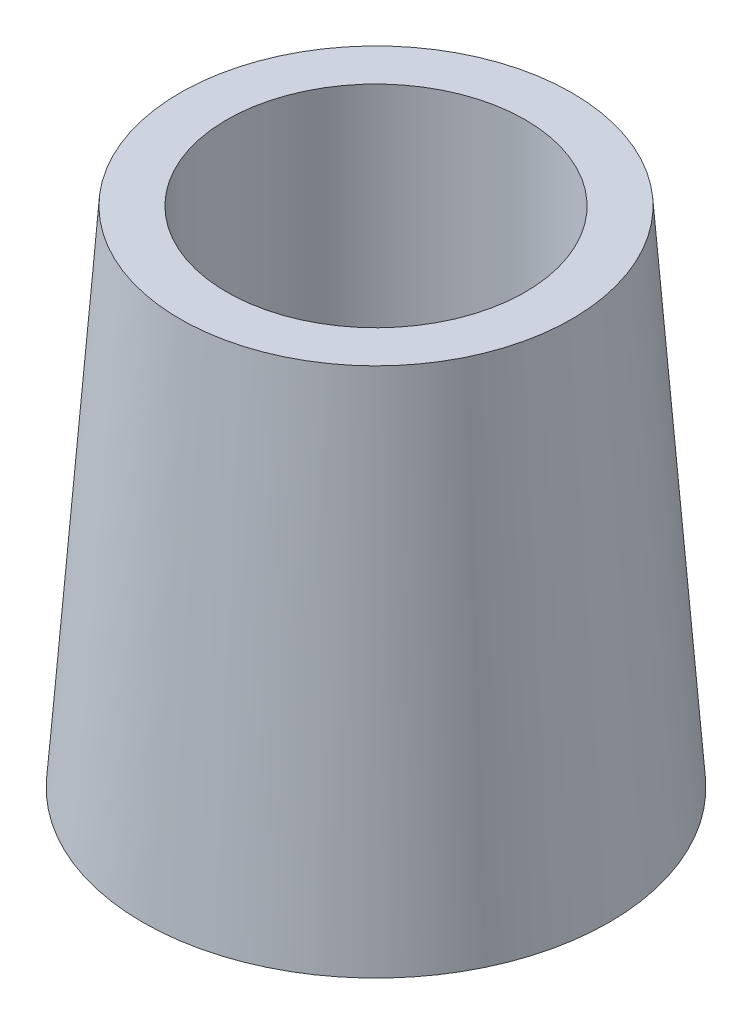
from build123d import *


with BuildPart() as part:
    # Sketch1 → Revolve1 (revolve)
    with BuildSketch(Plane.XY, mode=Mode.PRIVATE) as revolve1_sk:
        Polygon((10.5, 27), (12.5, 0), (8, 0), (8, 27), align=None)
    revolve(revolve1_sk.sketch.rotate(Axis((0, 0, 0), (0, 1, 0)), 90), axis=Axis((0, 0, 0), (0, 1, 0)))


solid = part.part
